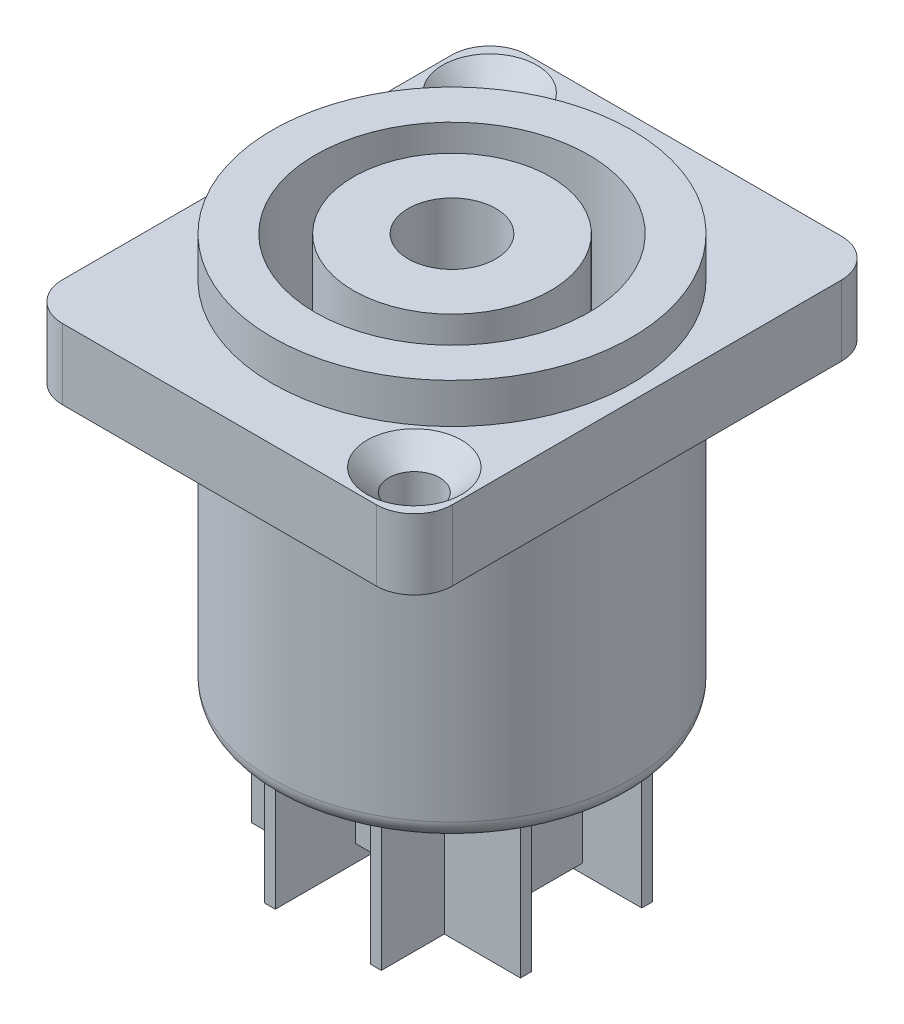
from build123d import *

# Parameters (mm, degrees)
BOSS_EXTRUDE1_DEPTH                             = 7.366
BOSS_EXTRUDE1_DEPTH_BACK                        = 19.431
SKETCH1_R                                       = 11.9888
SKETCH3_W                                       = 26.0096
SKETCH3_H                                       = 31.0388
BOSS_EXTRUDE3_DEPTH                             = 4.699
CSK_FOR_M3_FLAT_HEAD_MACHINE_SCREW2_D           = 3.4
CSK_FOR_M3_FLAT_HEAD_MACHINE_SCREW2_CSINK_D     = 6.3
CSK_FOR_M3_FLAT_HEAD_MACHINE_SCREW2_CSINK_ANGLE = 90
SKETCH11_R                                      = 9.1186
SKETCH11_R_2                                    = 6.5786
CUT_EXTRUDE1_DEPTH                              = 21.717
FILLET1_R                                       = 2.54
SKETCH12_R                                      = 2.921
CUT_EXTRUDE3_DEPTH                              = 21.717
BOSS_EXTRUDE4_DEPTH                             = 9.525
SKETCH14_W                                      = 4.7625
SKETCH14_H                                      = 0.508
SKETCH14_W_2                                    = 0.508
SKETCH14_H_2                                    = 4.7625
BOSS_EXTRUDE5_DEPTH                             = 7.62
FILLET2_R                                       = 1.27


with BuildPart() as part:
    # Sketch1 → Boss-Extrude1 (new, two sides: drawn at the far end of the back side and taken through both)
    with BuildSketch(Plane(origin=(0, 0, 0), x_dir=(1, 0, 0), z_dir=(0, 1, 0)).offset(-BOSS_EXTRUDE1_DEPTH_BACK)):
        with Locations(Location((0, 0, 0), (0, 0, 270))):
            Circle(SKETCH1_R)
    extrude(amount=BOSS_EXTRUDE1_DEPTH + BOSS_EXTRUDE1_DEPTH_BACK)

    # Sketch3 → Boss-Extrude3 (add)
    with BuildSketch(Plane(origin=(0, 0, 0), x_dir=(1, 0, 0), z_dir=(0, 1, 0))):
        Rectangle(SKETCH3_W, SKETCH3_H)
    extrude(amount=BOSS_EXTRUDE3_DEPTH)

    # CSK for M3 Flat Head Machine Screw2 (through all)
    with Locations(Plane(origin=(0, 4.699, 0), x_dir=(1, 0, 0), z_dir=(0, 1, 0))):
        with Locations((-9.5758, 12.0904), (9.5758, -12.0904)):
            CounterSinkHole(CSK_FOR_M3_FLAT_HEAD_MACHINE_SCREW2_D / 2, CSK_FOR_M3_FLAT_HEAD_MACHINE_SCREW2_CSINK_D / 2, counter_sink_angle=CSK_FOR_M3_FLAT_HEAD_MACHINE_SCREW2_CSINK_ANGLE)

    # Sketch11 → Cut-Extrude1 (cut)
    with BuildSketch(Plane(origin=(0, 7.366, 0), x_dir=(1, 0, 0), z_dir=(0, 1, 0))):
        with Locations(Location((0, 0, 0), (0, 0, 270))):
            Circle(SKETCH11_R)
        with Locations(Location((0, 0, 0), (0, 0, 270))):
            Circle(SKETCH11_R_2, mode=Mode.SUBTRACT)
    extrude(amount=-CUT_EXTRUDE1_DEPTH, mode=Mode.SUBTRACT)

    # Fillet1
    fillet1_edges = [part.edges().sort_by_distance(p)[0] for p in [
        (13.0048, 2.3495, -15.5194),
        (-13.0048, 2.3495, -15.5194),
        (-13.0048, 2.3495, 15.5194),
        (13.0048, 2.3495, 15.5194),
    ]]
    fillet(fillet1_edges, radius=FILLET1_R)

    # Sketch12 → Cut-Extrude3 (cut)
    with BuildSketch(Plane(origin=(0, 7.366, 0), x_dir=(1, 0, 0), z_dir=(0, 1, 0))):
        with Locations(Location((0, 0, 0), (0, 0, 270))):
            Circle(SKETCH12_R)
    extrude(amount=-CUT_EXTRUDE3_DEPTH, mode=Mode.SUBTRACT)

    # Sketch13 → Boss-Extrude4 (add)
    with BuildSketch(Plane.XZ.offset(19.431)):
        Polygon((3.175, 0.36195), (-3.175, 0.36195), (-3.175, 8.61695), (-3.8989, 8.61695), (-3.8989, 4.4069), (-8.9789, 4.4069), (-8.9789, 3.683), (-3.8989, 3.683), (-3.8989, -3.683), (-8.9789, -3.683), (-8.9789, -4.4069), (-3.8989, -4.4069), (-3.8989, -8.61695), (-3.175, -8.61695), (-3.175, -0.36195), (3.175, -0.36195), (3.175, -8.61695), (3.8989, -8.61695), (3.8989, -4.4069), (8.9789, -4.4069), (8.9789, -3.683), (3.8989, -3.683), (3.8989, 3.683), (8.9789, 3.683), (8.9789, 4.4069), (3.8989, 4.4069), (3.8989, 8.61695), (3.175, 8.61695), align=None)
    extrude(amount=BOSS_EXTRUDE4_DEPTH)

    # Sketch14 → Boss-Extrude5 (add)
    with BuildSketch(Plane.XZ.offset(19.431)):
        with Locations((0, 3.79095)):
            Rectangle(SKETCH14_W, SKETCH14_H)
        with Locations((-6.0579, 0)):
            Rectangle(SKETCH14_W_2, SKETCH14_H_2)
        with Locations((6.0579, 0)):
            Rectangle(SKETCH14_W_2, SKETCH14_H_2)
    extrude(amount=BOSS_EXTRUDE5_DEPTH)

    # Fillet2
    fillet2_edges = [part.edges().sort_by_distance(p)[0] for p in [
        (0, -19.431, -11.9888),
    ]]
    fillet(fillet2_edges, radius=FILLET2_R)


solid = part.part
